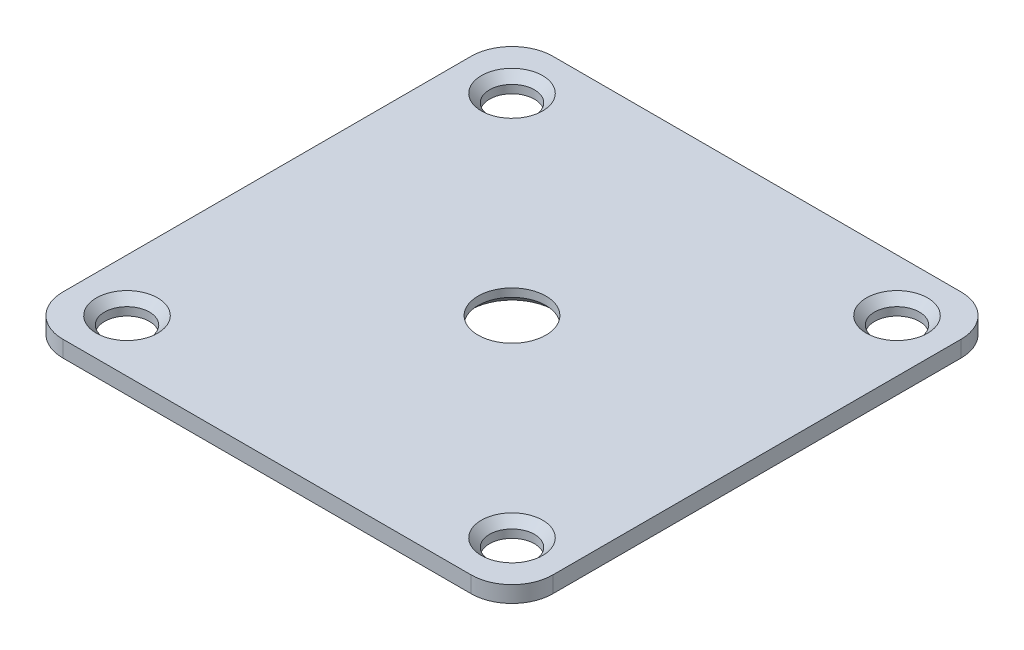
from build123d import *

# Parameters (mm, degrees)
SKETCH1_R           = 4.150000000000041
BOSS_EXTRUDE1_DEPTH = 2
CHAMFER1_SIZE       = 1
CHAMFER2_SIZE       = 1
FILLET1_R           = 5


with BuildPart() as part:
    # Sketch1 → Boss-Extrude1 (new body)
    with BuildSketch(Plane(origin=(0, 0, 0), x_dir=(1, 0, 0), z_dir=(0, 1, 0))):
        Polygon((30.00000000000003, 30.000000000000025), (-29.999999999999986, 30.000000000000025), (-29.99999999999997, -29.999999999999975), (30.00000000000003, -29.999999999999975), align=None)
        with BuildLine():
            ThreePointArc((-23.57000000000001, -20.819999999999983), (-21.625456351737007, -21.625456351736975), (-20.820000000000014, -23.56999999999998))
            ThreePointArc((-20.820000000000014, -23.56999999999998), (-25.514543648263015, -25.514543648262983), (-23.57000000000001, -20.819999999999983))
        make_face(mode=Mode.SUBTRACT)
        with BuildLine():
            ThreePointArc((26.319999999999983, -23.56999999999998), (23.569999999999986, -26.319999999999975), (20.81999999999999, -23.56999999999998))
            ThreePointArc((20.81999999999999, -23.56999999999998), (21.625456351736982, -21.625456351736975), (23.569999999999986, -20.819999999999983))
            ThreePointArc((23.569999999999986, -20.819999999999983), (25.51454364826299, -21.625456351736975), (26.319999999999983, -23.56999999999998))
        make_face(mode=Mode.SUBTRACT)
        with BuildLine():
            ThreePointArc((-23.57000000000002, 20.820000000000025), (-25.514543648263025, 25.514543648263025), (-20.820000000000025, 23.57000000000002))
            ThreePointArc((-20.820000000000025, 23.57000000000002), (-21.625456351737018, 21.625456351737018), (-23.57000000000002, 20.820000000000025))
        make_face(mode=Mode.SUBTRACT)
        Circle(SKETCH1_R, mode=Mode.SUBTRACT)
        with BuildLine():
            ThreePointArc((23.56999999999998, 20.820000000000025), (21.625456351736975, 21.625456351737018), (20.819999999999983, 23.57000000000002))
            ThreePointArc((20.819999999999983, 23.57000000000002), (23.56999999999998, 26.320000000000018), (26.319999999999975, 23.57000000000002))
            ThreePointArc((26.319999999999975, 23.57000000000002), (25.514543648262983, 21.625456351737018), (23.56999999999998, 20.820000000000025))
        make_face(mode=Mode.SUBTRACT)
    extrude(amount=BOSS_EXTRUDE1_DEPTH)

    # Chamfer1
    chamfer1_edges = [part.edges().sort_by_distance(p)[0] for p in [
        (20.819999999999983, 2, -23.57000000000002),
        (23.569999999999972, 2, 26.31999999999996),
        (-23.57000000000001, 2, 26.319999999999975),
        (-26.320000000000018, 2, -23.57000000000002),
    ]]
    chamfer(chamfer1_edges, length=CHAMFER1_SIZE)

    # Chamfer2
    chamfer2_edges = [part.edges().sort_by_distance(p)[0] for p in [
        (-4.150000000000013, 0, -2.356e-14),
    ]]
    chamfer(chamfer2_edges, length=CHAMFER2_SIZE)

    # Fillet1
    fillet1_edges = [part.edges().sort_by_distance(p)[0] for p in [
        (-29.999999999999986, 1, -30.000000000000025),
        (30.00000000000003, 1, -30.000000000000025),
        (-29.99999999999997, 1, 29.999999999999975),
        (30.00000000000003, 1, 29.999999999999975),
    ]]
    fillet(fillet1_edges, radius=FILLET1_R)


solid = part.part
